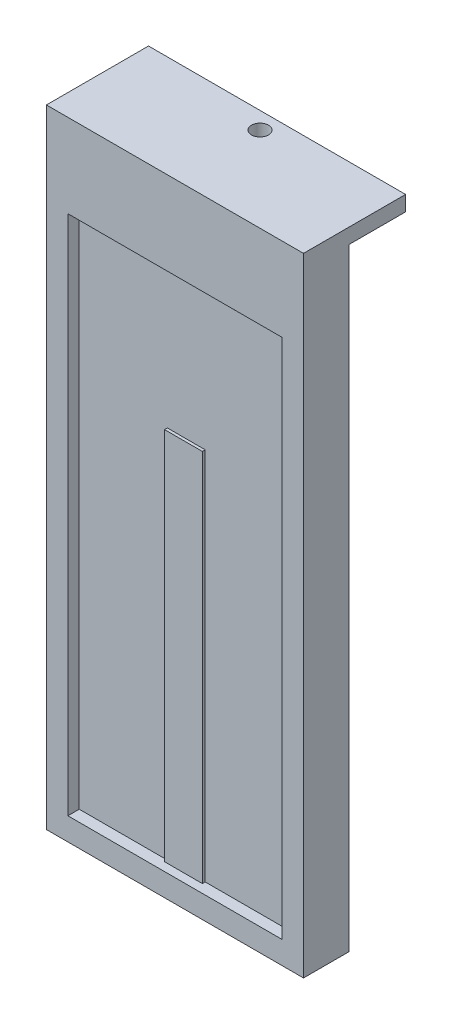
from build123d import *

# Parameters (mm, degrees)
SKETCH1_W           = 68
SKETCH1_H           = 162
BOSS_EXTRUDE1_DEPTH = 12
SKETCH2_W           = 68
SKETCH2_H           = 27
BOSS_EXTRUDE2_DEPTH = 4
SKETCH4_R           = 2.25
CUT_EXTRUDE1_DEPTH  = 171.108788721
SKETCH5_W           = 56.642
SKETCH5_H           = 137.922
CUT_EXTRUDE2_DEPTH  = 3
SKETCH6_W           = 10
SKETCH6_H           = 99
BOSS_EXTRUDE3_DEPTH = 0.746


with BuildPart() as part:
    # Sketch1 → Boss-Extrude1 (new body)
    with BuildSketch(Plane.XY):
        Rectangle(SKETCH1_W, SKETCH1_H)
    extrude(amount=BOSS_EXTRUDE1_DEPTH)

    # Sketch2 → Boss-Extrude2 (add)
    with BuildSketch(Plane(origin=(0, 81, 0), x_dir=(1, 0, 0), z_dir=(0, 1, 0))):
        with Locations((0, 1.5)):
            Rectangle(SKETCH2_W, SKETCH2_H)
    extrude(amount=BOSS_EXTRUDE2_DEPTH)

    # Sketch4 → Cut-Extrude1 (cut, through all)
    with BuildSketch(Plane(origin=(0, 85, 0), x_dir=(1, 0, 0), z_dir=(0, 1, 0))):
        with Locations(Location((0, 10.5, 0), (0, 0, 270))):
            Circle(SKETCH4_R)
    extrude(amount=-CUT_EXTRUDE1_DEPTH, mode=Mode.SUBTRACT)

    # Sketch5 → Cut-Extrude2 (cut)
    with BuildSketch(Plane.XY.offset(12)):
        with Locations((0, -6.039)):
            Rectangle(SKETCH5_W, SKETCH5_H)
    extrude(amount=-CUT_EXTRUDE2_DEPTH, mode=Mode.SUBTRACT)

    # Sketch6 → Boss-Extrude3 (add)
    with BuildSketch(Plane.XY.offset(9)):
        with Locations((0, -25.5)):
            Rectangle(SKETCH6_W, SKETCH6_H)
    extrude(amount=BOSS_EXTRUDE3_DEPTH)


solid = part.part
